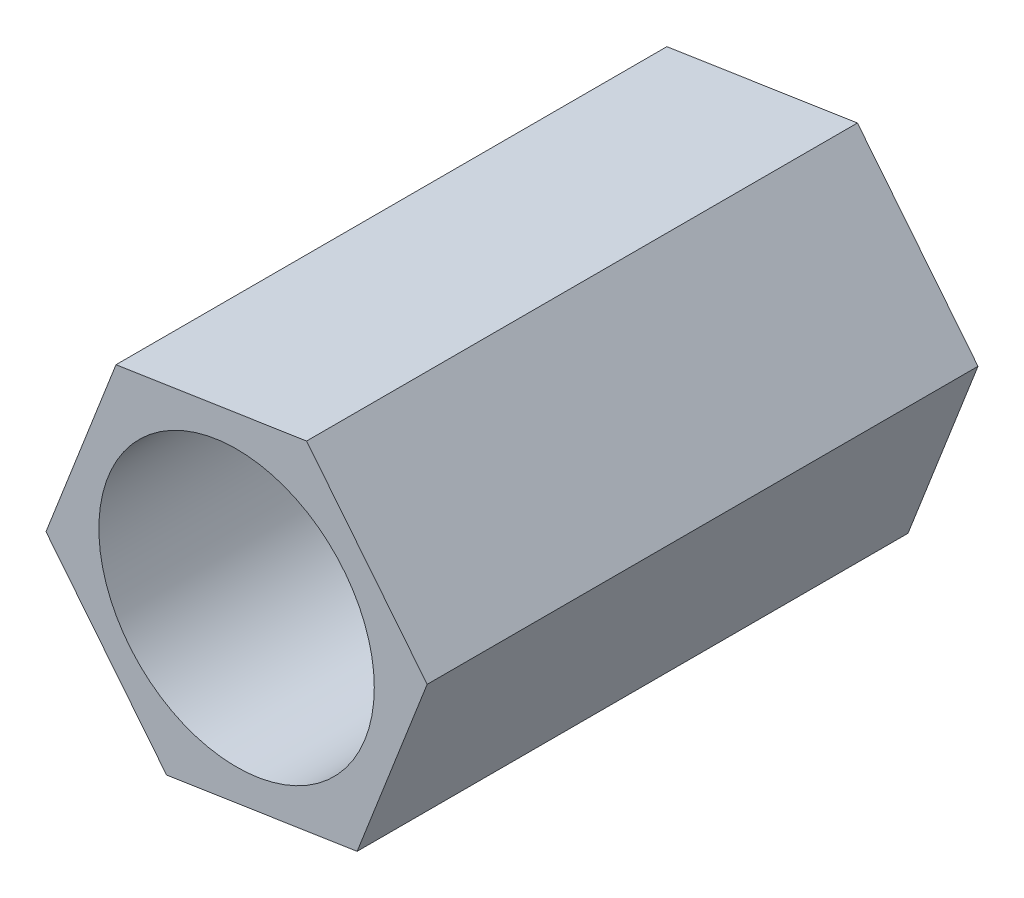
from build123d import *

# Parameters (mm, degrees)
SKETCH1_R           = 1.75
SKETCH1_R_2         = 1.25
BOSS_EXTRUDE1_DEPTH = 5
CUT_EXTRUDE2_START  = -12
CUT_EXTRUDE2_DEPTH  = 12


with BuildPart() as part:
    # Sketch1 → Boss-Extrude1 (new body)
    with BuildSketch(Plane.XY):
        Circle(SKETCH1_R)
        Circle(SKETCH1_R_2, mode=Mode.SUBTRACT)
    extrude(amount=BOSS_EXTRUDE1_DEPTH)

    # Sketch2 → Cut-Extrude2 (cut)
    with BuildSketch(Plane.XY.offset(5).offset(CUT_EXTRUDE2_START)):
        with BuildLine():
            ThreePointArc((-1.09434695, 1.365615156), (-1.630539837, 0.635483942), (-1.729830892, -0.264924681))
            Line((-1.729830892, -0.264924681), (-1.09434695, 1.365615156))
        make_face()
        with BuildLine():
            Line((-1.09434695, 1.365615156), (0.635483942, 1.630539837))
            ThreePointArc((0.635483942, 1.630539837), (-0.264924681, 1.729830892), (-1.09434695, 1.365615156))
        make_face()
        with BuildLine():
            Line((0.635483942, 1.630539837), (1.729830892, 0.264924681))
            ThreePointArc((1.729830892, 0.264924681), (1.365615156, 1.09434695), (0.635483942, 1.630539837))
        make_face()
        with BuildLine():
            Line((1.729830892, 0.264924681), (1.09434695, -1.365615156))
            ThreePointArc((1.09434695, -1.365615156), (1.577594238, -0.757427501), (1.75, 0))
            ThreePointArc((1.75, 0), (1.744950438, 0.132845662), (1.729830892, 0.264924681))
        make_face()
        with BuildLine():
            ThreePointArc((-0.635483942, -1.630539837), (0.264924681, -1.729830892), (1.09434695, -1.365615156))
            Line((1.09434695, -1.365615156), (-0.635483942, -1.630539837))
        make_face()
        with BuildLine():
            ThreePointArc((-1.729830892, -0.264924681), (-1.365615156, -1.09434695), (-0.635483942, -1.630539837))
            Line((-0.635483942, -1.630539837), (-1.729830892, -0.264924681))
        make_face()
    extrude(amount=CUT_EXTRUDE2_DEPTH, mode=Mode.SUBTRACT)


solid = part.part
